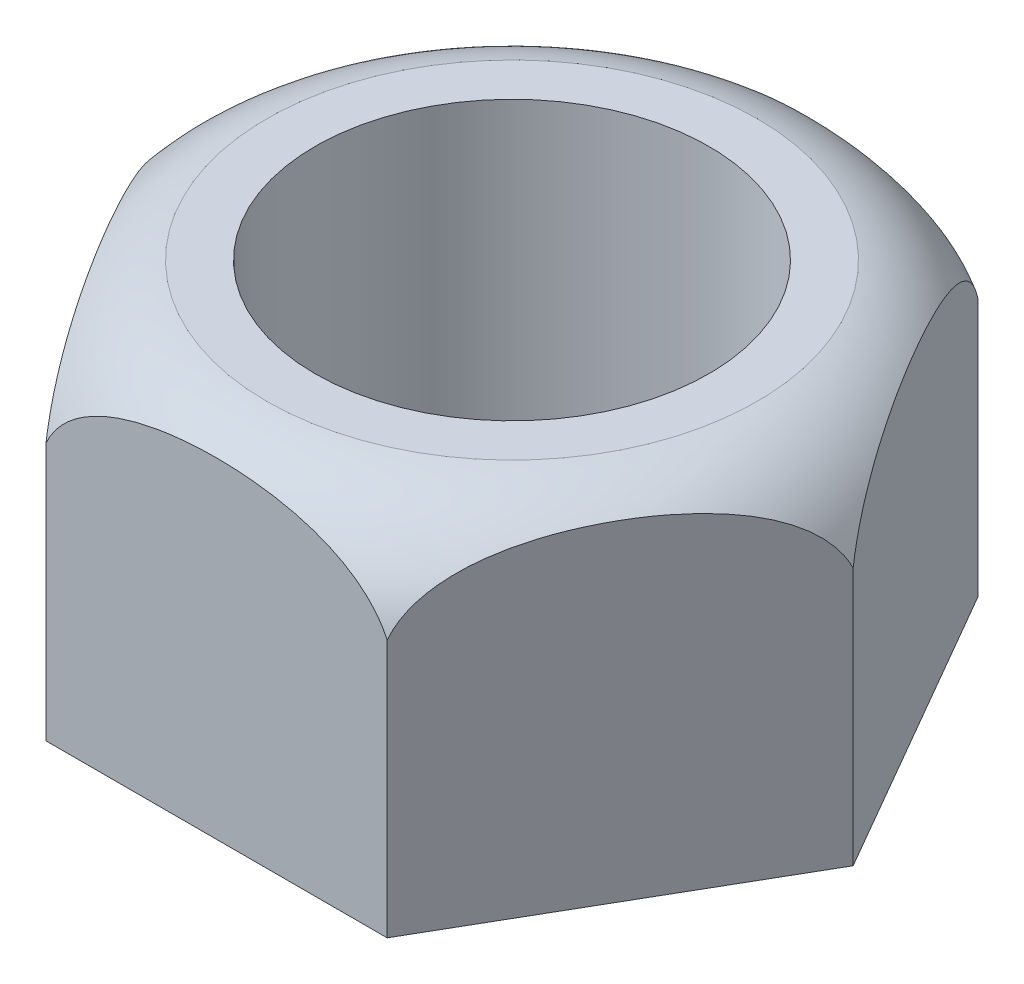
from build123d import *

# Parameters (mm, degrees)
BOSS_EXTRU_1_DEPTH      = 8.5598
ESQUISSE2_R             = 4.7625
ENL_V_MAT_EXTRU_1_DEPTH = 14.86894224


with BuildPart() as part:
    # Esquisse1 → Boss.-Extru.1 (new body)
    with BuildSketch(Plane(origin=(0, 0, 0), x_dir=(1, 0, 0), z_dir=(0, 1, 0))):
        Polygon((4.124445986, 7.14375), (-4.124445986, 7.14375), (-8.248891971, 0), (-4.124445986, -7.14375), (4.124445986, -7.14375), (8.248891971, 0), align=None)
    extrude(amount=BOSS_EXTRU_1_DEPTH)

    # Esquisse2 → Enlèv. mat.-Extru.1 (cut, through all)
    with BuildSketch(Plane(origin=(0, 8.5598, 0), x_dir=(1, 0, 0), z_dir=(0, 1, 0))):
        with Locations(Location((0, 0, 0), (0, 0, 270))):
            Circle(ESQUISSE2_R)
    extrude(amount=-ENL_V_MAT_EXTRU_1_DEPTH, mode=Mode.SUBTRACT)

    # Esquisse6 → Enlèvement de matière-Révolution1 (revolve, cut)
    with BuildSketch(Plane.XY, mode=Mode.PRIVATE) as enl_vement_de_mati_re_r_volution1_sk:
        with BuildLine():
            Line((-8.248891971, 8.5598), (-7.086761314, 8.5598))
            Line((-7.086761314, 8.5598), (-5.924630657, 8.5598))
            ThreePointArc((-5.924630657, 8.5598), (-7.427141503, 7.738049532), (-8.248891971, 6.235538686))
            Line((-8.248891971, 6.235538686), (-8.248891971, 7.397669343))
            Line((-8.248891971, 7.397669343), (-8.248891971, 8.5598))
        make_face()
    revolve(enl_vement_de_mati_re_r_volution1_sk.sketch.rotate(Axis((0, 0, 0), (0, 1, 0)), 270), axis=Axis((0, 0, 0), (0, 1, 0)), mode=Mode.SUBTRACT)


solid = part.part
